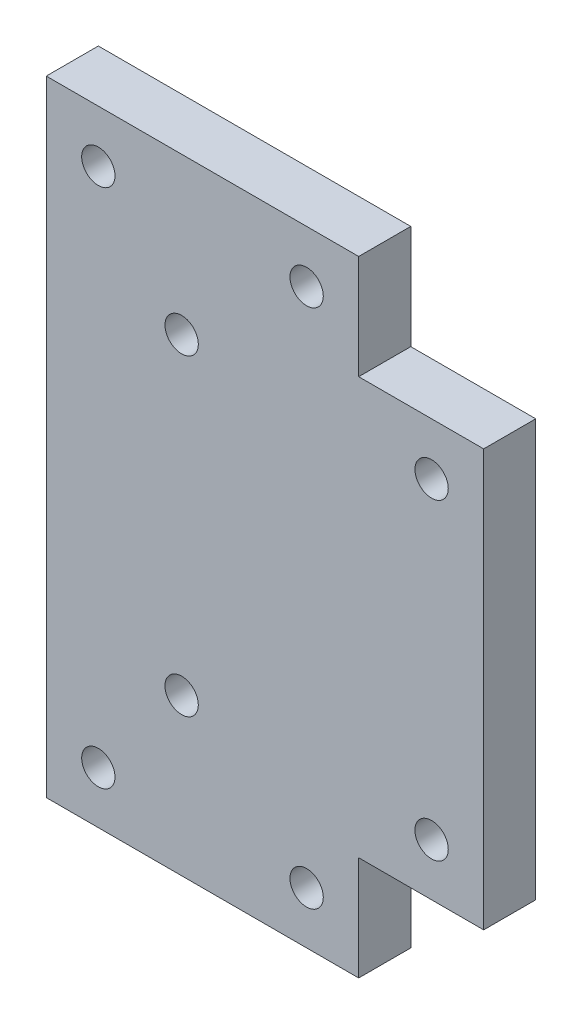
from build123d import *

# Parameters (mm, degrees)
EXTRUDE_1_DEPTH     = 5
SKETCH_5_R          = 1.6
CUT_EXTRUDE_1_DEPTH = 329.148213465
SKETCH_6_W          = 3
SKETCH_6_H          = 30
CUT_EXTRUDE_2_DEPTH = 329.148213465
SKETCH_7_W          = 3
SKETCH_7_H          = 10
CUT_EXTRUDE_3_DEPTH = 329.148213465
SKETCH_8_W          = 15
SKETCH_8_H          = 3
CUT_EXTRUDE_4_DEPTH = 329.148213465
SKETCH_9_W          = 30
SKETCH_9_H          = 0.36
EXTRUDE_2_DEPTH     = 5
SKETCH_11_W         = 200
SKETCH_11_H         = 355
SKETCH_11_W_2       = 46
SKETCH_11_H_2       = 60
CUT_EXTRUDE_5_DEPTH = 329.148213465
CUT_EXTRUDE_7_DEPTH = 221.184013952
SKETCH_13_R         = 1.6
CUT_EXTRUDE_8_DEPTH = 220.018264079


with BuildPart() as part:
    # 草图3 → 凸台-拉伸1 (new body)
    with BuildSketch(Plane.XY):
        Polygon((-10, 267.5), (190, 267.5), (190, 230), (160, 230), (160, 130), (190, 130), (190, 50), (160, 50), (160, -50), (190, -50), (190, -87.5), (-10, -87.5), (-10, -50), (20, -50), (20, 50), (-10, 50), (-10, 130), (20, 130), (20, 230), (-10, 230), align=None)
    extrude(amount=EXTRUDE_1_DEPTH)

    # 草图5 → 切除-拉伸1 (cut, through all)
    with BuildSketch(Plane.XY.offset(5)):
        with Locations((33, 195)):
            Circle(SKETCH_5_R)
        with Locations((57, 195)):
            Circle(SKETCH_5_R)
        with Locations((33, 165)):
            Circle(SKETCH_5_R)
        with Locations((57, 165)):
            Circle(SKETCH_5_R)
        with Locations((123, 195)):
            Circle(SKETCH_5_R)
        with Locations((147, 195)):
            Circle(SKETCH_5_R)
        with Locations((123, 165)):
            Circle(SKETCH_5_R)
        with Locations((147, 165)):
            Circle(SKETCH_5_R)
        with Locations((33, 15)):
            Circle(SKETCH_5_R)
        with Locations((57, 15)):
            Circle(SKETCH_5_R)
        with Locations((33, -15)):
            Circle(SKETCH_5_R)
        with Locations((57, -15)):
            Circle(SKETCH_5_R)
        with Locations((123, 15)):
            Circle(SKETCH_5_R)
        with Locations((147, 15)):
            Circle(SKETCH_5_R)
        with Locations((123, -15)):
            Circle(SKETCH_5_R)
        with Locations((147, -15)):
            Circle(SKETCH_5_R)
    extrude(amount=-CUT_EXTRUDE_1_DEPTH, mode=Mode.SUBTRACT)

    # 草图6 → 切除-拉伸2 (cut, through all)
    with BuildSketch(Plane.XY.offset(5)):
        with Locations((-8.5, 90)):
            Rectangle(SKETCH_6_W, SKETCH_6_H)
        with Locations((188.5, 90)):
            Rectangle(SKETCH_6_W, SKETCH_6_H)
    extrude(amount=-CUT_EXTRUDE_2_DEPTH, mode=Mode.SUBTRACT)

    # 草图7 → 切除-拉伸3 (cut, through all)
    with BuildSketch(Plane.XY.offset(5)):
        with Locations((-8.5, 248.75)):
            Rectangle(SKETCH_7_W, SKETCH_7_H)
        with Locations((188.5, 248.75)):
            Rectangle(SKETCH_7_W, SKETCH_7_H)
        with Locations((-8.5, -68.75)):
            Rectangle(SKETCH_7_W, SKETCH_7_H)
        with Locations((188.5, -68.75)):
            Rectangle(SKETCH_7_W, SKETCH_7_H)
    extrude(amount=-CUT_EXTRUDE_3_DEPTH, mode=Mode.SUBTRACT)

    # 草图8 → 切除-拉伸4 (cut, through all)
    with BuildSketch(Plane.XY.offset(5)):
        with Locations((17.5, -86)):
            Rectangle(SKETCH_8_W, SKETCH_8_H)
        with Locations((52.5, -86)):
            Rectangle(SKETCH_8_W, SKETCH_8_H)
        with Locations((127.5, -86)):
            Rectangle(SKETCH_8_W, SKETCH_8_H)
        with Locations((162.5, -86)):
            Rectangle(SKETCH_8_W, SKETCH_8_H)
    extrude(amount=-CUT_EXTRUDE_4_DEPTH, mode=Mode.SUBTRACT)

    # 草图9 → 凸台-拉伸2 (add)
    with BuildSketch(Plane.XY.offset(5)):
        with Locations((5, 229.82)):
            Rectangle(SKETCH_9_W, SKETCH_9_H)
        with Locations((175, 229.82)):
            Rectangle(SKETCH_9_W, SKETCH_9_H)
    extrude(amount=-EXTRUDE_2_DEPTH)

    # 草图11 → 切除-拉伸5 (cut, through all)
    with BuildSketch(Plane.XY.offset(5)):
        with Locations((90, 90)):
            Rectangle(SKETCH_11_W, SKETCH_11_H)
        with Locations((43, 180)):
            Rectangle(SKETCH_11_W_2, SKETCH_11_H_2, mode=Mode.SUBTRACT)
    extrude(amount=-CUT_EXTRUDE_5_DEPTH, mode=Mode.SUBTRACT)

    # 草图14 → 切除-拉伸7 (cut, through all)
    with BuildSketch(Plane(origin=(0, 0, 0), x_dir=(-1, 0, 0), z_dir=(0, 0, -1))):
        Polygon((-66, 150), (-50, 150), (-50, 160), (-62, 160), (-62, 200), (-50, 200), (-50, 210), (-66, 210), (-66, 200), (-66, 160), align=None)
    extrude(amount=-CUT_EXTRUDE_7_DEPTH, mode=Mode.SUBTRACT)

    # 草图13 → 切除-拉伸8 (cut, through all)
    with BuildSketch(Plane.XY.offset(5)):
        with Locations((45, 205)):
            Circle(SKETCH_13_R)
        with Locations((25, 155)):
            Circle(SKETCH_13_R)
        with Locations((25, 205)):
            Circle(SKETCH_13_R)
        with Locations((45, 155)):
            Circle(SKETCH_13_R)
    extrude(amount=-CUT_EXTRUDE_8_DEPTH, mode=Mode.SUBTRACT)


solid = part.part
